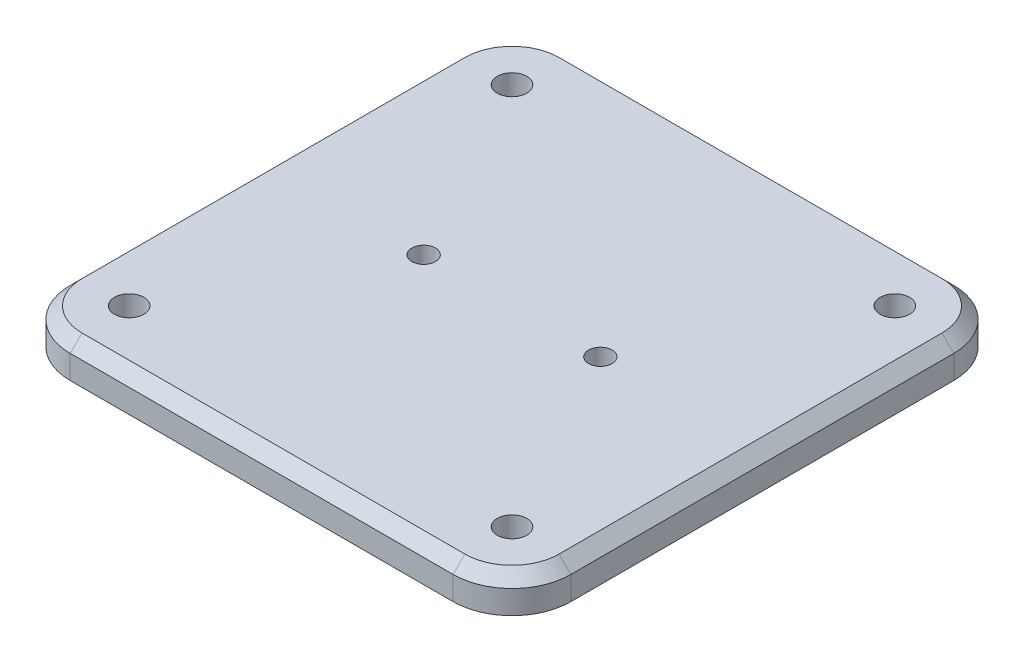
from build123d import *

# Parameters (mm, degrees)
SKETCH1_R                 = 2.5
BOSS_EXTRUDE1_DEPTH       = 6
CHAMFER1_SIZE             = 2
M4X0_7_TAPPED_HOLE2_D     = 4
M4X0_7_TAPPED_HOLE2_DEPTH = 8.898278762
M4X0_7_TAPPED_HOLE2_TIP   = 1.201721238


with BuildPart() as part:
    # Sketch1 → Boss-Extrude1 (new body)
    with BuildSketch(Plane(origin=(0, 0, 0), x_dir=(1, 0, 0), z_dir=(0, 1, 0))):
        with BuildLine():
            Line((-32.5, -42.5), (32.5, -42.5))
            ThreePointArc((32.5, -42.5), (39.571067812, -39.571067812), (42.5, -32.5))
            Line((42.5, -32.5), (42.5, 32.5))
            ThreePointArc((42.5, 32.5), (39.571067812, 39.571067812), (32.5, 42.5))
            Line((32.5, 42.5), (-32.5, 42.5))
            ThreePointArc((-32.5, 42.5), (-39.571067812, 39.571067812), (-42.5, 32.5))
            Line((-42.5, 32.5), (-42.5, -32.5))
            ThreePointArc((-42.5, -32.5), (-39.571067812, -39.571067812), (-32.5, -42.5))
        make_face()
        with Locations(Location((-32.5, 32.5, 0), (0, 0, 270))):
            Circle(SKETCH1_R, mode=Mode.SUBTRACT)
        with Locations(Location((32.5, 32.5, 0), (0, 0, 90))):
            Circle(SKETCH1_R, mode=Mode.SUBTRACT)
        with Locations(Location((32.5, -32.5, 0), (0, 0, 270))):
            Circle(SKETCH1_R, mode=Mode.SUBTRACT)
        with Locations(Location((-32.5, -32.5, 0), (0, 0, 90))):
            Circle(SKETCH1_R, mode=Mode.SUBTRACT)
    extrude(amount=BOSS_EXTRUDE1_DEPTH)

    # Chamfer1
    chamfer1_edges = [part.edges().sort_by_distance(p)[0] for p in [
        (39.571067812, 6, -39.571067812),
        (42.5, 6, 0),
        (39.571067812, 6, 39.571067812),
        (0, 6, 42.5),
        (-39.571067812, 6, 39.571067812),
    ]]
    chamfer(chamfer1_edges, length=CHAMFER1_SIZE)

    # M4x0.7 Tapped Hole2
    with Locations(Plane(origin=(0, 6, 0), x_dir=(1, 0, 0), z_dir=(0, 1, 0))):
        with Locations((-15, 0), (15, 0)):
            Hole(M4X0_7_TAPPED_HOLE2_D / 2, depth=M4X0_7_TAPPED_HOLE2_DEPTH)
            with Locations((0, 0, -(M4X0_7_TAPPED_HOLE2_DEPTH + M4X0_7_TAPPED_HOLE2_TIP / 2))):  # 118° drill point
                Cone(0, M4X0_7_TAPPED_HOLE2_D / 2, M4X0_7_TAPPED_HOLE2_TIP, mode=Mode.SUBTRACT)


solid = part.part
